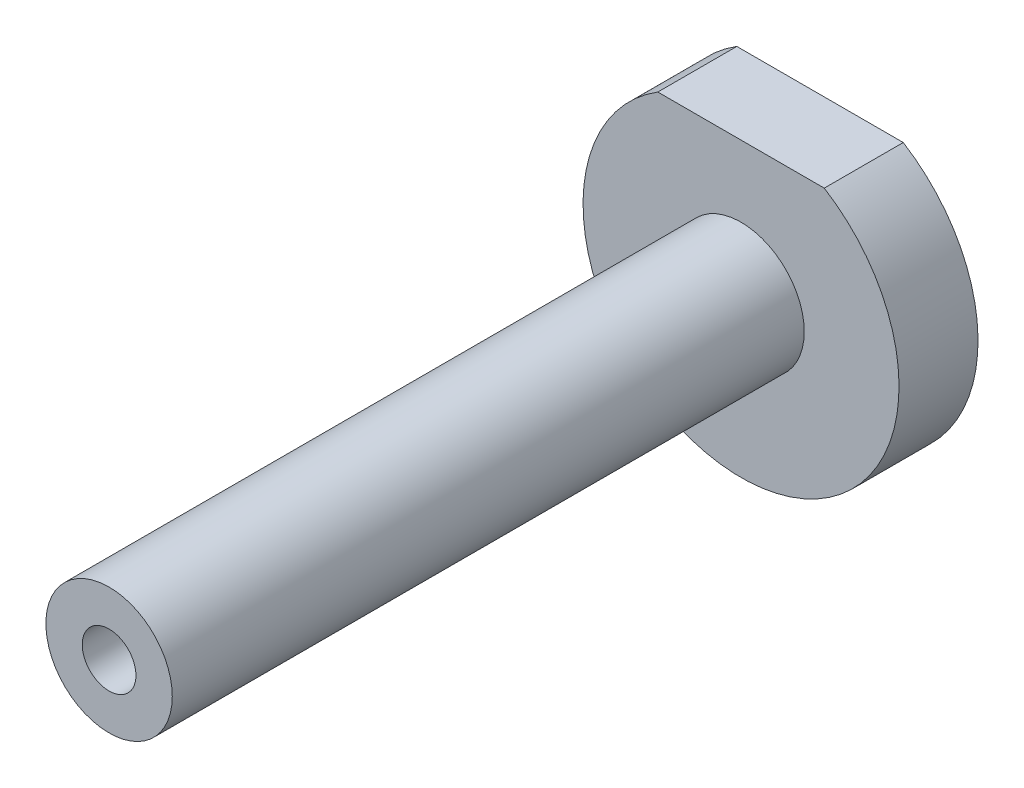
from build123d import *

# Parameters (mm, degrees)
ESQUISSE1_R             = 20
BOSS_EXTRU_1_DEPTH      = 10
ESQUISSE2_R             = 8
BOSS_EXTRU_2_DEPTH      = 80
ESQUISSE3_W             = 36.346174344
ESQUISSE3_H             = 6
ENL_V_MAT_EXTRU_3_DEPTH = 41


with BuildPart() as part:
    # Esquisse1 → Boss.-Extru.1 (new body)
    with BuildSketch(Plane.XY):
        Circle(ESQUISSE1_R)
    extrude(amount=BOSS_EXTRU_1_DEPTH)

    # Esquisse2 → Boss.-Extru.2 (add)
    with BuildSketch(Plane.XY.offset(10)):
        Circle(ESQUISSE2_R)
    extrude(amount=BOSS_EXTRU_2_DEPTH)

    # Esquisse3 → Enlèv. mat.-Extru.3 (cut)
    with BuildSketch(Plane.XY):
        with Locations((0, 20)):
            Rectangle(ESQUISSE3_W, ESQUISSE3_H)
    extrude(amount=ENL_V_MAT_EXTRU_3_DEPTH, mode=Mode.SUBTRACT)

    # Esquisse5 → Trou taraudé M81 (revolve, cut)
    with BuildSketch(Plane(origin=(0, 0, 90), x_dir=(0, -1, 0), z_dir=(1, 0, 0))):
        Polygon((0, 0), (0, 24.292926105), (3.4, 22.25), (3.4, 0), align=None)
    revolve(axis=Axis((0, 0, 96.35), (0, 0, -1)), mode=Mode.SUBTRACT)


solid = part.part
